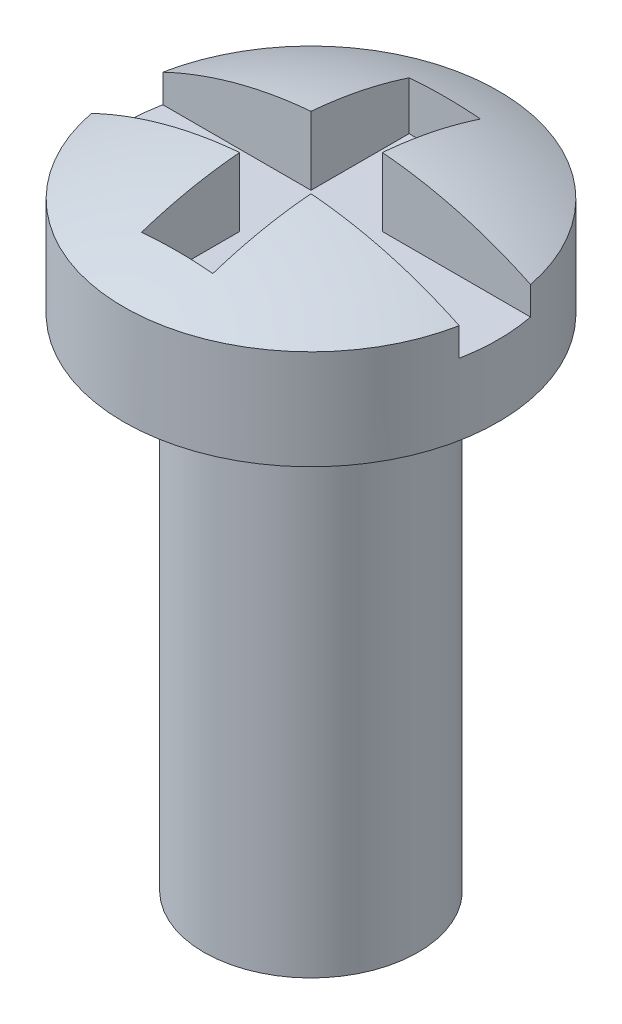
from build123d import *

# Parameters (mm, degrees)
SKETCH_1_R          = 1.5
EXTRUDE_1_DEPTH     = 7
SKETCH_2_R          = 2.625
EXTRUDE_2_DEPTH     = 2
SKETCH_3_W          = 7.004697232
SKETCH_3_H          = 1
CUT_EXTRUDE_1_DEPTH = 1
SKETCH_4_W          = 1
SKETCH_4_H          = 3.75
CUT_EXTRUDE_2_DEPTH = 1


with BuildPart() as part:
    # 草图1 → 拉伸1 (new body)
    with BuildSketch(Plane(origin=(0, 0, 0), x_dir=(1, 0, 0), z_dir=(0, 1, 0))):
        with Locations(Location((0, 0, 0), (0, 0, 270))):
            Circle(SKETCH_1_R)
    extrude(amount=EXTRUDE_1_DEPTH)

    # 草图2 → 拉伸2 (add)
    with BuildSketch(Plane(origin=(0, 7, 0), x_dir=(-1, 0, 0), z_dir=(0, 1, 0))):
        with Locations(Location((0, 0, 0), (0, 0, 90))):
            Circle(SKETCH_2_R)
    extrude(amount=EXTRUDE_2_DEPTH)

    # 草图3 → 切除-拉伸1 (cut)
    with BuildSketch(Plane(origin=(0, 9, 0), x_dir=(-1, 0, 0), z_dir=(0, 1, 0))):
        Rectangle(SKETCH_3_W, SKETCH_3_H)
    extrude(amount=-CUT_EXTRUDE_1_DEPTH, mode=Mode.SUBTRACT)

    # 草图4 → 切除-拉伸2 (cut)
    with BuildSketch(Plane(origin=(0, 9, 0), x_dir=(-1, 0, 0), z_dir=(0, 1, 0))):
        Rectangle(SKETCH_4_W, SKETCH_4_H)
    extrude(amount=-CUT_EXTRUDE_2_DEPTH, mode=Mode.SUBTRACT)

    # 草图5 → 切除-旋转16 (revolve, cut)
    with BuildSketch(Plane(origin=(0, 0, 0), x_dir=(0, 0, -1), z_dir=(1, 0, 0)), mode=Mode.PRIVATE) as cut_revolve_16_sk:
        with BuildLine():
            Line((0, 10.999822694), (-4.5493707, 10.999822694))
            Line((-4.5493707, 10.999822694), (-4.5493707, 6.911933822))
            ThreePointArc((-4.5493707, 6.911933822), (-2.502838096, 8.453054325), (0, 9))
            Line((0, 9), (0, 10.999822694))
        make_face()
    revolve(cut_revolve_16_sk.sketch.rotate(Axis((0, -2.105917543, 0), (0, 1, 0)), 259.019424572), axis=Axis((0, -2.105917543, 0), (0, 1, 0)), mode=Mode.SUBTRACT)


solid = part.part
